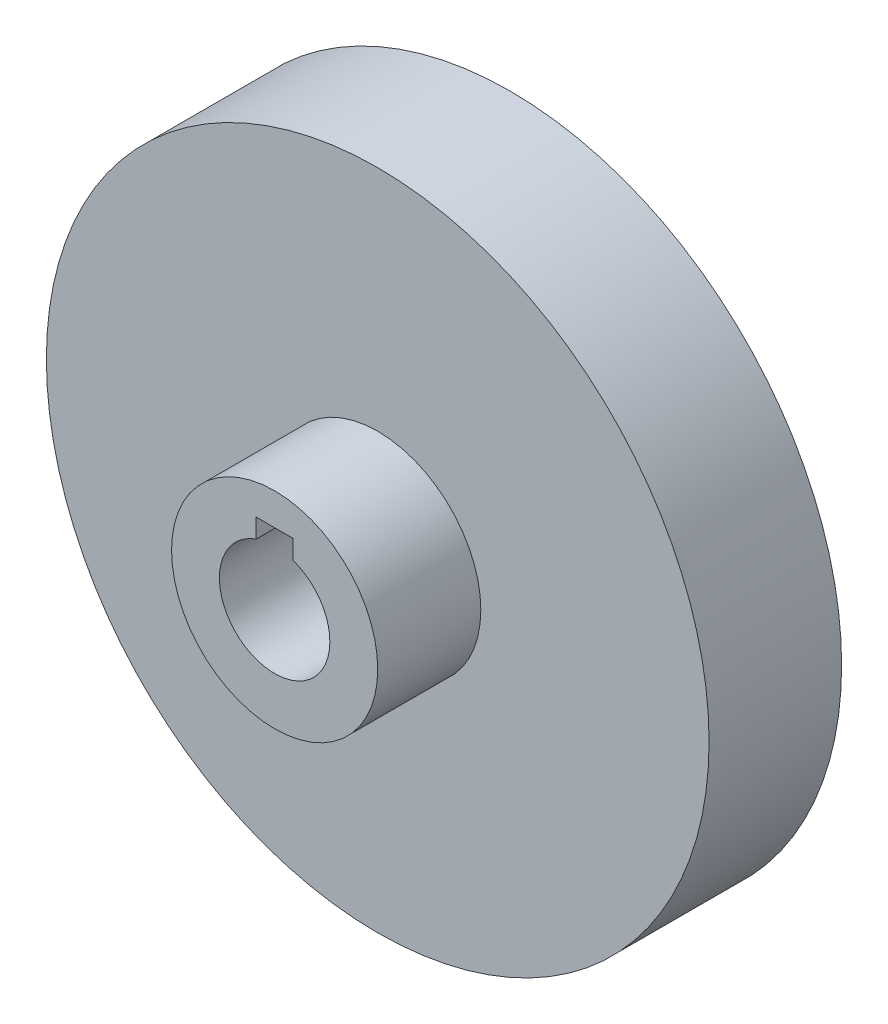
from build123d import *

# Parameters (mm, degrees)
CUT_EXTRUDE1_DEPTH = 2.5


with BuildPart() as part:
    # Sketch1 → Revolve1 (revolve)
    with BuildSketch(Plane(origin=(0, 0, 0), x_dir=(0, 0, -1), z_dir=(1, 0, 0)), mode=Mode.PRIVATE) as revolve1_sk:
        Polygon((-23, 7.5), (-23, 14), (-9, 14), (-9, 45), (9, 45), (9, 14), (12, 14), (12, 7.5), align=None)
    revolve(revolve1_sk.sketch.rotate(Axis((0, 0, 42.784), (0, 0, -1)), 90), axis=Axis((0, 0, 42.784), (0, 0, -1)))

    # Sketch2 → Cut-Extrude1 (cut, symmetric)
    with BuildSketch(Plane(origin=(0, 0, 0), x_dir=(0, 0, -1), z_dir=(1, 0, 0))):
        Polygon((-23, 9.65), (-23, 5), (12, 5), (12, 10), align=None)
    extrude(amount=CUT_EXTRUDE1_DEPTH, both=True, mode=Mode.SUBTRACT)


solid = part.part
